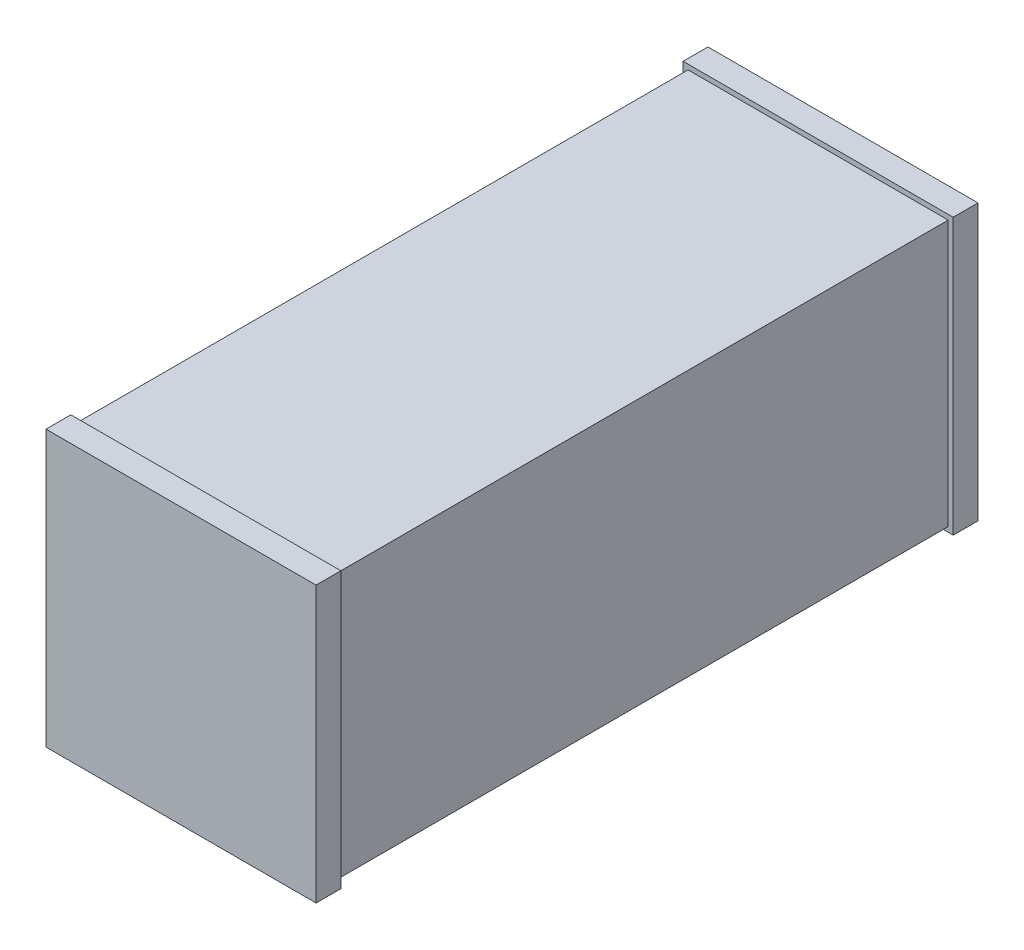
from build123d import *

# Parameters (mm, degrees)
SKETCH1_W                     = 103.632
SKETCH1_H                     = 105.664
BOSS_EXTRUDE1_DEPTH           = 9.525
SKETCH2_W                     = 99.822
SKETCH2_H                     = 101.854
BOSS_EXTRUDE2_DEPTH           = 234.95
SKETCH4_W                     = 103.632
SKETCH4_H                     = 105.664
BOSS_EXTRUDE5_DEPTH           = 9.525
TAP_DRILL_FOR_6_32_TAP1_D     = 2.7051
TAP_DRILL_FOR_6_32_TAP1_DEPTH = 3.97002
TAP_DRILL_FOR_6_32_TAP1_TIP   = 0.81269403


with BuildPart() as part:
    # Sketch1 → Boss-Extrude1 (new body)
    with BuildSketch(Plane.XY):
        with Locations((51.816, -52.832)):
            Rectangle(SKETCH1_W, SKETCH1_H)
    extrude(amount=-BOSS_EXTRUDE1_DEPTH)

    # Sketch2 → Boss-Extrude2 (add)
    with BuildSketch(Plane(origin=(0, 0, -9.525), x_dir=(-1, 0, 0), z_dir=(0, 0, -1))):
        with Locations((-51.816, -52.832)):
            Rectangle(SKETCH2_W, SKETCH2_H)
    extrude(amount=BOSS_EXTRUDE2_DEPTH)

    # Sketch4 → Boss-Extrude5 (add)
    with BuildSketch(Plane(origin=(0, 0, -244.475), x_dir=(-1, 0, 0), z_dir=(0, 0, -1))):
        with Locations((-51.816, -52.832)):
            Rectangle(SKETCH4_W, SKETCH4_H)
    extrude(amount=BOSS_EXTRUDE5_DEPTH)

    # Tap Drill for #6-32 Tap1
    with Locations(Plane(origin=(0, -103.759, 0), x_dir=(-1, 0, 0), z_dir=(0, -1, 0))):
        with Locations((-88.3285, 234.95), (-15.3035, 234.95), (-88.3285, 19.05), (-15.3035, 19.05)):
            Hole(TAP_DRILL_FOR_6_32_TAP1_D / 2, depth=TAP_DRILL_FOR_6_32_TAP1_DEPTH)
            with Locations((0, 0, -(TAP_DRILL_FOR_6_32_TAP1_DEPTH + TAP_DRILL_FOR_6_32_TAP1_TIP / 2))):  # 118° drill point
                Cone(0, TAP_DRILL_FOR_6_32_TAP1_D / 2, TAP_DRILL_FOR_6_32_TAP1_TIP, mode=Mode.SUBTRACT)


solid = part.part
